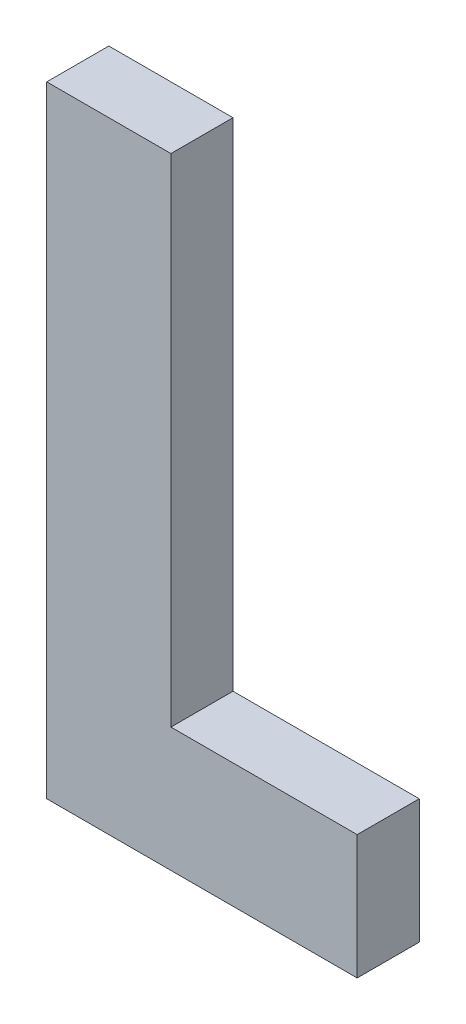
from build123d import *

# Parameters (mm, degrees)
BOSS_EXTRUDE1_DEPTH = 10


with BuildPart() as part:
    # Sketch2 → Boss-Extrude1 (new body)
    with BuildSketch(Plane.XY):
        Polygon((0, 0), (20, 0), (20, -80), (50, -80), (50, -100), (0, -100), (0, -80), align=None)
    extrude(amount=BOSS_EXTRUDE1_DEPTH)


solid = part.part
